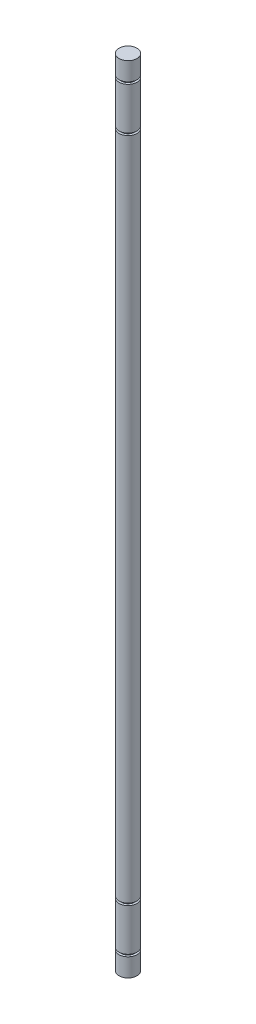
from build123d import *

# Parameters (mm, degrees)
SKETCH1_R           = 1.5875
BOSS_EXTRUDE1_DEPTH = 70.0659
SKETCH2_W           = 0.381
SKETCH2_H           = 0.381


with BuildPart() as part:
    # Sketch1 → Boss-Extrude1 (new, symmetric)
    with BuildSketch(Plane(origin=(0, 0, 0), x_dir=(1, 0, 0), z_dir=(0, 1, 0))):
        with Locations(Location((0, 0, 0), (0, 0, 270))):
            Circle(SKETCH1_R)
    extrude(amount=BOSS_EXTRUDE1_DEPTH, both=True)

    # Sketch2 → Cut-Revolve1 (revolve, cut)
    with BuildSketch(Plane.XY, mode=Mode.PRIVATE) as cut_revolve1_sk:
        with Locations((1.397, 58.8137)):
            Rectangle(SKETCH2_W, SKETCH2_H)
        with Locations((1.397, -58.8137)):
            Rectangle(SKETCH2_W, SKETCH2_H)
        with Locations((1.397, 66.6369)):
            Rectangle(SKETCH2_W, SKETCH2_H)
        with Locations((1.397, -66.6369)):
            Rectangle(SKETCH2_W, SKETCH2_H)
    revolve(cut_revolve1_sk.sketch.rotate(Axis((0, -58.6232, 0), (0, 1, 0)), 90), axis=Axis((0, -58.6232, 0), (0, 1, 0)), mode=Mode.SUBTRACT)


solid = part.part
